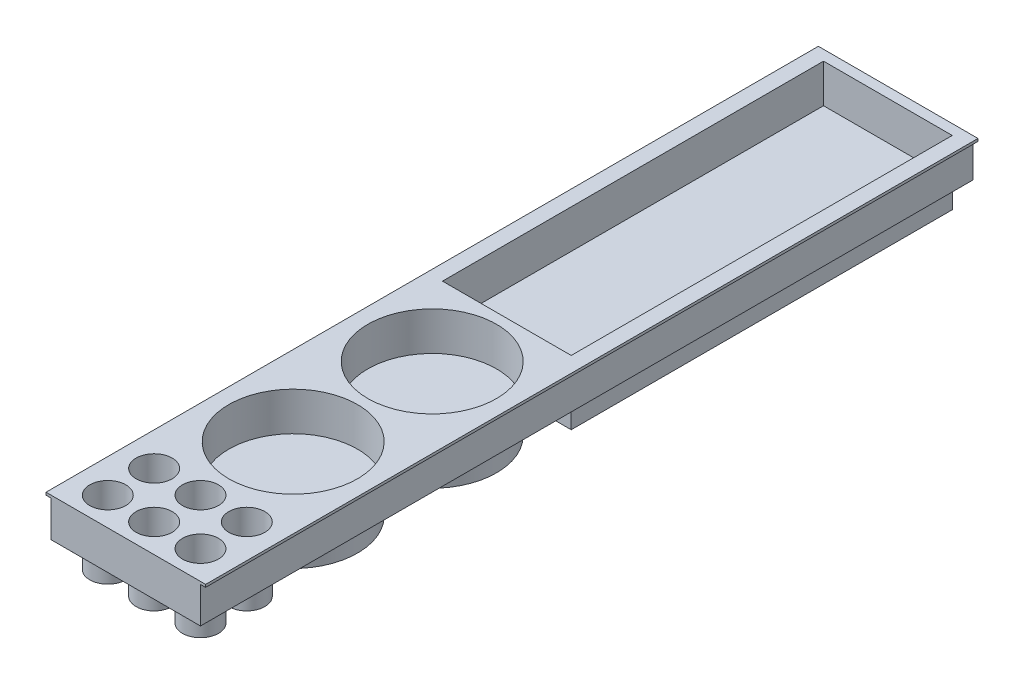
from build123d import *

# Parameters (mm, degrees)
SKETCH1_W             = 58
SKETCH1_H             = 300
SKETCH1_R             = 7
SKETCH1_R_2           = 25
SKETCH1_W_2           = 50
SKETCH1_H_2           = 148
BOSS_EXTRUDE1_DEPTH   = 15
BOSS_EXTRUDE2_START   = -15
SKETCH3_W             = 50
SKETCH3_H             = 148
BOSS_EXTRUDE2_DEPTH   = 10
SKETCH3_R             = 25
BOSS_EXTRUDE2_2_DEPTH = 10
BOSS_EXTRUDE2_3_DEPTH = 10
SKETCH3_R_2           = 7
BOSS_EXTRUDE2_4_DEPTH = 10
BOSS_EXTRUDE2_5_DEPTH = 10
BOSS_EXTRUDE2_6_DEPTH = 10
BOSS_EXTRUDE2_7_DEPTH = 10
BOSS_EXTRUDE2_8_DEPTH = 10
BOSS_EXTRUDE2_9_DEPTH = 10
SKETCH6_W             = 2
SKETCH6_H             = 300
BOSS_EXTRUDE4_DEPTH   = 1


with BuildPart() as part:
    # Sketch1 → Boss-Extrude1 (new body)
    with BuildSketch(Plane(origin=(0, 0, 0), x_dir=(1, 0, 0), z_dir=(0, 1, 0))):
        with Locations((0, -72)):
            Rectangle(SKETCH1_W, SKETCH1_H)
        with Locations(Location((-18, -193, 0), (0, 0, 270))):
            Circle(SKETCH1_R, mode=Mode.SUBTRACT)
        with Locations(Location((0, -193, 0), (0, 0, 270))):
            Circle(SKETCH1_R, mode=Mode.SUBTRACT)
        with Locations(Location((18, -193, 0), (0, 0, 270))):
            Circle(SKETCH1_R, mode=Mode.SUBTRACT)
        with Locations(Location((-18, -211, 0), (0, 0, 270))):
            Circle(SKETCH1_R, mode=Mode.SUBTRACT)
        with Locations(Location((0, -211, 0), (0, 0, 270))):
            Circle(SKETCH1_R, mode=Mode.SUBTRACT)
        with Locations(Location((18, -211, 0), (0, 0, 270))):
            Circle(SKETCH1_R, mode=Mode.SUBTRACT)
        with Locations(Location((0, -157, 0), (0, 0, 270))):
            Circle(SKETCH1_R_2, mode=Mode.SUBTRACT)
        with Locations(Location((0, -103, 0), (0, 0, 270))):
            Circle(SKETCH1_R_2, mode=Mode.SUBTRACT)
        Rectangle(SKETCH1_W_2, SKETCH1_H_2, mode=Mode.SUBTRACT)
    extrude(amount=-BOSS_EXTRUDE1_DEPTH)

    # Sketch6 → Boss-Extrude4 (add)
    with BuildSketch(Plane(origin=(0, 0, 0), x_dir=(1, 0, 0), z_dir=(0, 1, 0))):
        with Locations((-30, -72)):
            Rectangle(SKETCH6_W, SKETCH6_H)
        with Locations((30, -72)):
            Rectangle(SKETCH6_W, SKETCH6_H)
    extrude(amount=-BOSS_EXTRUDE4_DEPTH)


with BuildPart() as body_2:
    # Sketch3 → Boss-Extrude2 (new body)
    with BuildSketch(Plane(origin=(0, 0, 0), x_dir=(1, 0, 0), z_dir=(0, 1, 0)).offset(BOSS_EXTRUDE2_START)):
        Rectangle(SKETCH3_W, SKETCH3_H)
    extrude(amount=-BOSS_EXTRUDE2_DEPTH)


with BuildPart() as body_3:
    # Sketch3 → Boss-Extrude2 2 (new body)
    with BuildSketch(Plane(origin=(0, 0, 0), x_dir=(1, 0, 0), z_dir=(0, 1, 0)).offset(BOSS_EXTRUDE2_START)):
        with Locations(Location((0, -103, 0), (0, 0, 270))):
            Circle(SKETCH3_R)
    extrude(amount=-BOSS_EXTRUDE2_2_DEPTH)


with BuildPart() as body_4:
    # Sketch3 → Boss-Extrude2 3 (new body)
    with BuildSketch(Plane(origin=(0, 0, 0), x_dir=(1, 0, 0), z_dir=(0, 1, 0)).offset(BOSS_EXTRUDE2_START)):
        with Locations(Location((0, -157, 0), (0, 0, 270))):
            Circle(SKETCH3_R)
    extrude(amount=-BOSS_EXTRUDE2_3_DEPTH)


with BuildPart() as body_5:
    # Sketch3 → Boss-Extrude2 4 (new body)
    with BuildSketch(Plane(origin=(0, 0, 0), x_dir=(1, 0, 0), z_dir=(0, 1, 0)).offset(BOSS_EXTRUDE2_START)):
        with Locations(Location((-18, -193, 0), (0, 0, 270))):
            Circle(SKETCH3_R_2)
    extrude(amount=-BOSS_EXTRUDE2_4_DEPTH)


with BuildPart() as body_6:
    # Sketch3 → Boss-Extrude2 5 (new body)
    with BuildSketch(Plane(origin=(0, 0, 0), x_dir=(1, 0, 0), z_dir=(0, 1, 0)).offset(BOSS_EXTRUDE2_START)):
        with Locations(Location((0, -193, 0), (0, 0, 270))):
            Circle(SKETCH3_R_2)
    extrude(amount=-BOSS_EXTRUDE2_5_DEPTH)


with BuildPart() as body_7:
    # Sketch3 → Boss-Extrude2 6 (new body)
    with BuildSketch(Plane(origin=(0, 0, 0), x_dir=(1, 0, 0), z_dir=(0, 1, 0)).offset(BOSS_EXTRUDE2_START)):
        with Locations(Location((18, -193, 0), (0, 0, 270))):
            Circle(SKETCH3_R_2)
    extrude(amount=-BOSS_EXTRUDE2_6_DEPTH)


with BuildPart() as body_8:
    # Sketch3 → Boss-Extrude2 7 (new body)
    with BuildSketch(Plane(origin=(0, 0, 0), x_dir=(1, 0, 0), z_dir=(0, 1, 0)).offset(BOSS_EXTRUDE2_START)):
        with Locations(Location((18, -211, 0), (0, 0, 270))):
            Circle(SKETCH3_R_2)
    extrude(amount=-BOSS_EXTRUDE2_7_DEPTH)


with BuildPart() as body_9:
    # Sketch3 → Boss-Extrude2 8 (new body)
    with BuildSketch(Plane(origin=(0, 0, 0), x_dir=(1, 0, 0), z_dir=(0, 1, 0)).offset(BOSS_EXTRUDE2_START)):
        with Locations(Location((0, -211, 0), (0, 0, 270))):
            Circle(SKETCH3_R_2)
    extrude(amount=-BOSS_EXTRUDE2_8_DEPTH)


with BuildPart() as body_10:
    # Sketch3 → Boss-Extrude2 9 (new body)
    with BuildSketch(Plane(origin=(0, 0, 0), x_dir=(1, 0, 0), z_dir=(0, 1, 0)).offset(BOSS_EXTRUDE2_START)):
        with Locations(Location((-18, -211, 0), (0, 0, 270))):
            Circle(SKETCH3_R_2)
    extrude(amount=-BOSS_EXTRUDE2_9_DEPTH)


solid = Compound([part.part, body_2.part, body_3.part, body_4.part, body_5.part, body_6.part, body_7.part, body_8.part, body_9.part, body_10.part])
